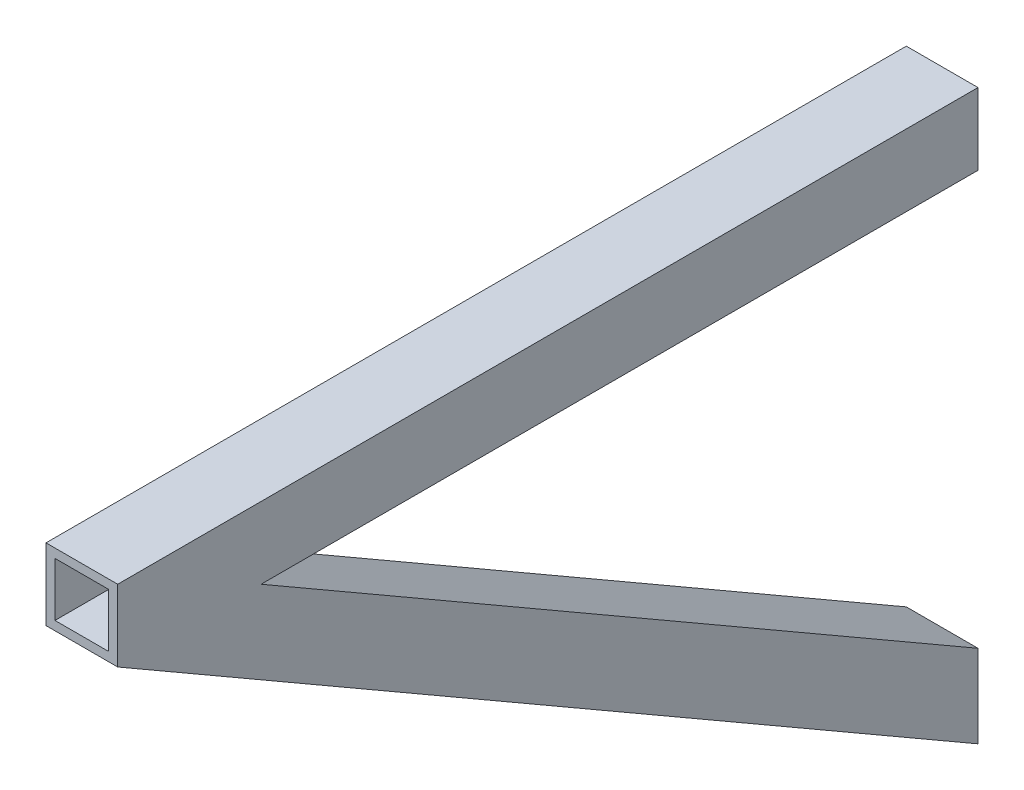
from build123d import *

# Parameters (mm, degrees)
SKETCH1_W           = 25.4
SKETCH1_H           = 25.4
SKETCH1_W_2         = 19.05
SKETCH1_H_2         = 19.05
BOSS_EXTRUDE1_DEPTH = 304.8
SKETCH2_W           = 25.4
SKETCH2_H           = 50.8
SKETCH2_W_2         = 19.05
SKETCH2_H_2         = 38.1
SKETCH4_W           = 26.690109794
SKETCH4_H           = 109.792846898
CUT_EXTRUDE1_DEPTH  = 375.380835514


with BuildPart() as part:
    # Sketch1 → Boss-Extrude1 (new body)
    with BuildSketch(Plane.XY):
        with Locations((12.7, 12.7)):
            Rectangle(SKETCH1_W, SKETCH1_H)
        with Locations((12.7, 12.7)):
            Rectangle(SKETCH1_W_2, SKETCH1_H_2, mode=Mode.SUBTRACT)
    extrude(amount=BOSS_EXTRUDE1_DEPTH)

    # Sweep1: sweep along a path in Sketch3
    with BuildLine(Plane(origin=(25.4, 0, 0), x_dir=(0, 0, -1), z_dir=(1, 0, 0))) as sweep1_path:
        Line((-279.4, 0), (50.555678842, -190.5))
    # Sketch2 → Sweep1 (sweep)
    with BuildSketch(Plane.XZ):
        with Locations((12.7, 279.4)):
            Rectangle(SKETCH2_W, SKETCH2_H)
        with Locations((12.7, 279.4)):
            Rectangle(SKETCH2_W_2, SKETCH2_H_2, mode=Mode.SUBTRACT)
    sweep(path=sweep1_path.line)

    # Sketch4 → Cut-Extrude1 (cut, through all)
    with BuildSketch(Plane(origin=(0, 25.4, 0), x_dir=(1, 0, 0), z_dir=(0, 1, 0))):
        with Locations((13.345054897, 54.896423449)):
            Rectangle(SKETCH4_W, SKETCH4_H)
    extrude(amount=-CUT_EXTRUDE1_DEPTH, mode=Mode.SUBTRACT)


solid = part.part
